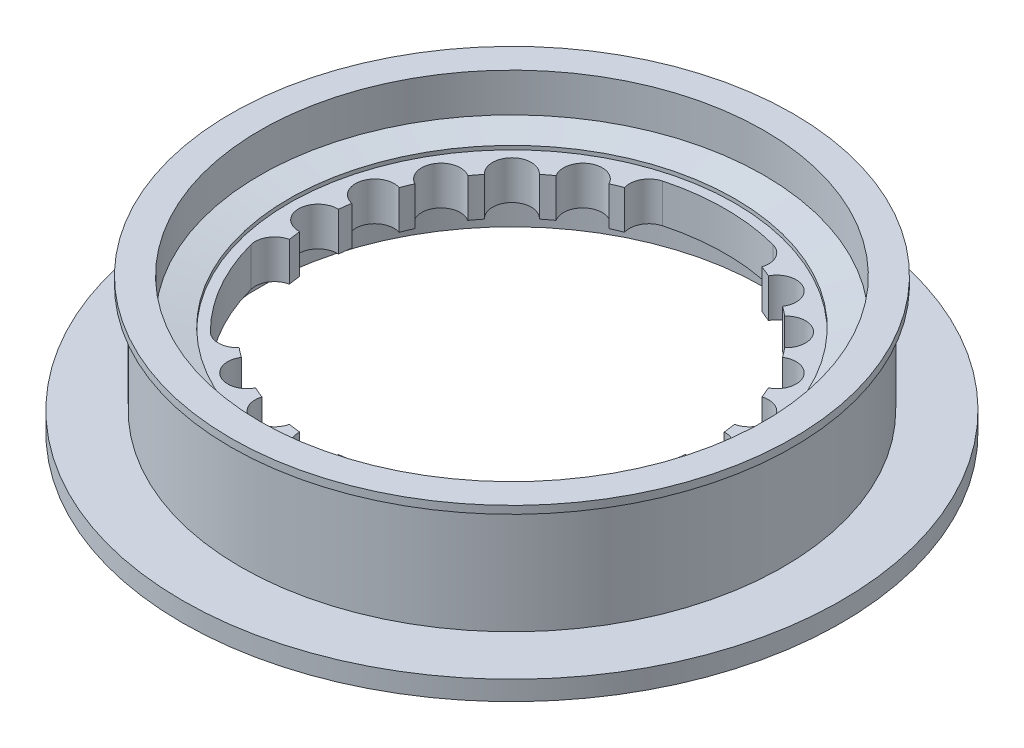
from build123d import *

# Parameters (mm, degrees)
SKETCH_1_R          = 17
EXTRUDE_1_DEPTH     = 1
SKETCH_2_R          = 14
EXTRUDE_2_DEPTH     = 5.6
SKETCH_3_R          = 14.5
EXTRUDE_3_DEPTH     = 0.4
CUT_EXTRUDE_1_REACH = 26.459


with BuildPart() as part:
    # 草图1 → 凸台-拉伸1 (new body)
    with BuildSketch(Plane(origin=(0, 0, 0), x_dir=(1, 0, 0), z_dir=(0, 1, 0))):
        with Locations(Location((0, 0, 0), (0, 0, 270))):
            Circle(SKETCH_1_R)
    extrude(amount=EXTRUDE_1_DEPTH)

    # 草图2 → 凸台-拉伸2 (add)
    with BuildSketch(Plane(origin=(0, 1, 0), x_dir=(1, 0, 0), z_dir=(0, 1, 0))):
        with Locations(Location((0, 0, 0), (0, 0, 270))):
            Circle(SKETCH_2_R)
    extrude(amount=EXTRUDE_2_DEPTH)

    # 草图3 → 凸台-拉伸3 (add)
    with BuildSketch(Plane(origin=(0, 6.6, 0), x_dir=(1, 0, 0), z_dir=(0, 1, 0))):
        with Locations(Location((0, 0, 0), (0, 0, 270))):
            Circle(SKETCH_3_R)
    extrude(amount=EXTRUDE_3_DEPTH)

    # 草图4 → 切除-旋转1 (revolve, cut)
    with BuildSketch(Plane(origin=(0, 0, 0), x_dir=(0, 0, -1), z_dir=(1, 0, 0))):
        Polygon((0, 0), (13, 0), (13, 2), (11.5, 2.3), (11.5, 2.5), (0, 2.5), align=None)
        Polygon((11.5, 4.7), (11.5, 4.5), (0, 4.5), (0, 7), (13, 7), (13, 5), align=None)
    revolve(axis=Axis((0, 4.5, 0), (0, 1, 0)), mode=Mode.SUBTRACT)

    # 草图5 → 切除-拉伸1 (cut, up to next)
    with BuildSketch(Plane(origin=(0, 4.5, 0), x_dir=(1, 0, 0), z_dir=(0, 1, 0)), mode=Mode.PRIVATE) as cut_extrude_1_sk1:
        with BuildLine():
            ThreePointArc((3.539967162, 9.352466653), (3.466448921, 10.137444482), (2.847009496, 10.625184089))
            ThreePointArc((2.847009496, 10.625184089), (0, 11), (-2.847009496, 10.625184089))
            ThreePointArc((-2.847009496, 10.625184089), (-3.466448921, 10.137444482), (-3.539967162, 9.352466653))
            ThreePointArc((-3.539967162, 9.352466653), (-3.826834324, 9.238795325), (-4.110057805, 9.116327377))
            ThreePointArc((-4.110057805, 9.116327377), (-5.5, 9.526279442), (-5.839942195, 8.117578159))
            ThreePointArc((-5.839942195, 8.117578159), (-6.08761429, 7.933533403), (-6.329490128, 7.741934817))
            ThreePointArc((-6.329490128, 7.741934817), (-7.778174593, 7.778174593), (-7.741934817, 6.329490128))
            ThreePointArc((-7.741934817, 6.329490128), (-7.933533403, 6.08761429), (-8.117578159, 5.839942195))
            ThreePointArc((-8.117578159, 5.839942195), (-9.526279442, 5.5), (-9.116327377, 4.110057805))
            ThreePointArc((-9.116327377, 4.110057805), (-9.238795325, 3.826834324), (-9.352466653, 3.539967162))
            ThreePointArc((-9.352466653, 3.539967162), (-10.625184089, 2.847009496), (-9.86945729, 1.610531835))
            ThreePointArc((-9.86945729, 1.610531835), (-9.914448614, 1.305261922), (-9.95, 0.998749218))
            ThreePointArc((-9.95, 0.998749218), (-11, 0), (-9.95, -0.998749218))
            ThreePointArc((-9.95, -0.998749218), (-9.914448614, -1.305261922), (-9.86945729, -1.610531835))
            ThreePointArc((-9.86945729, -1.610531835), (-10.512508911, -2.066689415), (-10.625184089, -2.847009496))
            ThreePointArc((-10.625184089, -2.847009496), (-9.526279442, -5.5), (-7.778174593, -7.778174593))
            ThreePointArc((-7.778174593, -7.778174593), (-7.046059991, -8.070755067), (-6.329490128, -7.741934817))
            ThreePointArc((-6.329490128, -7.741934817), (-6.08761429, -7.933533403), (-5.839942195, -8.117578159))
            ThreePointArc((-5.839942195, -8.117578159), (-5.5, -9.526279442), (-4.110057805, -9.116327377))
            ThreePointArc((-4.110057805, -9.116327377), (-3.826834324, -9.238795325), (-3.539967162, -9.352466653))
            ThreePointArc((-3.539967162, -9.352466653), (-2.847009496, -10.625184089), (-1.610531835, -9.86945729))
            ThreePointArc((-1.610531835, -9.86945729), (-1.305261922, -9.914448614), (-0.998749218, -9.95))
            ThreePointArc((-0.998749218, -9.95), (0, -11), (0.998749218, -9.95))
            ThreePointArc((0.998749218, -9.95), (1.305261922, -9.914448614), (1.610531835, -9.86945729))
            ThreePointArc((1.610531835, -9.86945729), (2.847009496, -10.625184089), (3.539967162, -9.352466653))
            ThreePointArc((3.539967162, -9.352466653), (3.826834324, -9.238795325), (4.110057805, -9.116327377))
            ThreePointArc((4.110057805, -9.116327377), (5.5, -9.526279442), (5.839942195, -8.117578159))
            ThreePointArc((5.839942195, -8.117578159), (6.08761429, -7.933533403), (6.329490128, -7.741934817))
            ThreePointArc((6.329490128, -7.741934817), (7.046059991, -8.070755067), (7.778174593, -7.778174593))
            ThreePointArc((7.778174593, -7.778174593), (9.526279442, -5.5), (10.625184089, -2.847009496))
            ThreePointArc((10.625184089, -2.847009496), (10.512508911, -2.066689415), (9.86945729, -1.610531835))
            ThreePointArc((9.86945729, -1.610531835), (9.914448614, -1.305261922), (9.95, -0.998749218))
            ThreePointArc((9.95, -0.998749218), (11, 0), (9.95, 0.998749218))
            ThreePointArc((9.95, 0.998749218), (9.914448614, 1.305261922), (9.86945729, 1.610531835))
            ThreePointArc((9.86945729, 1.610531835), (10.625184089, 2.847009496), (9.352466653, 3.539967162))
            ThreePointArc((9.352466653, 3.539967162), (9.238795325, 3.826834324), (9.116327377, 4.110057805))
            ThreePointArc((9.116327377, 4.110057805), (9.526279442, 5.5), (8.117578159, 5.839942195))
            ThreePointArc((8.117578159, 5.839942195), (7.933533403, 6.08761429), (7.741934817, 6.329490128))
            ThreePointArc((7.741934817, 6.329490128), (7.778174593, 7.778174593), (6.329490128, 7.741934817))
            ThreePointArc((6.329490128, 7.741934817), (6.08761429, 7.933533403), (5.839942195, 8.117578159))
            ThreePointArc((5.839942195, 8.117578159), (5.5, 9.526279442), (4.110057805, 9.116327377))
            ThreePointArc((4.110057805, 9.116327377), (3.826834324, 9.238795325), (3.539967162, 9.352466653))
        make_face()
    cut_extrude_1_tool1 = extrude(cut_extrude_1_sk1.sketch, amount=-CUT_EXTRUDE_1_REACH, mode=Mode.PRIVATE) & part.part
    add(cut_extrude_1_tool1.solids().sort_by_distance((0, 4.5, 0))[0], mode=Mode.SUBTRACT)


solid = part.part
